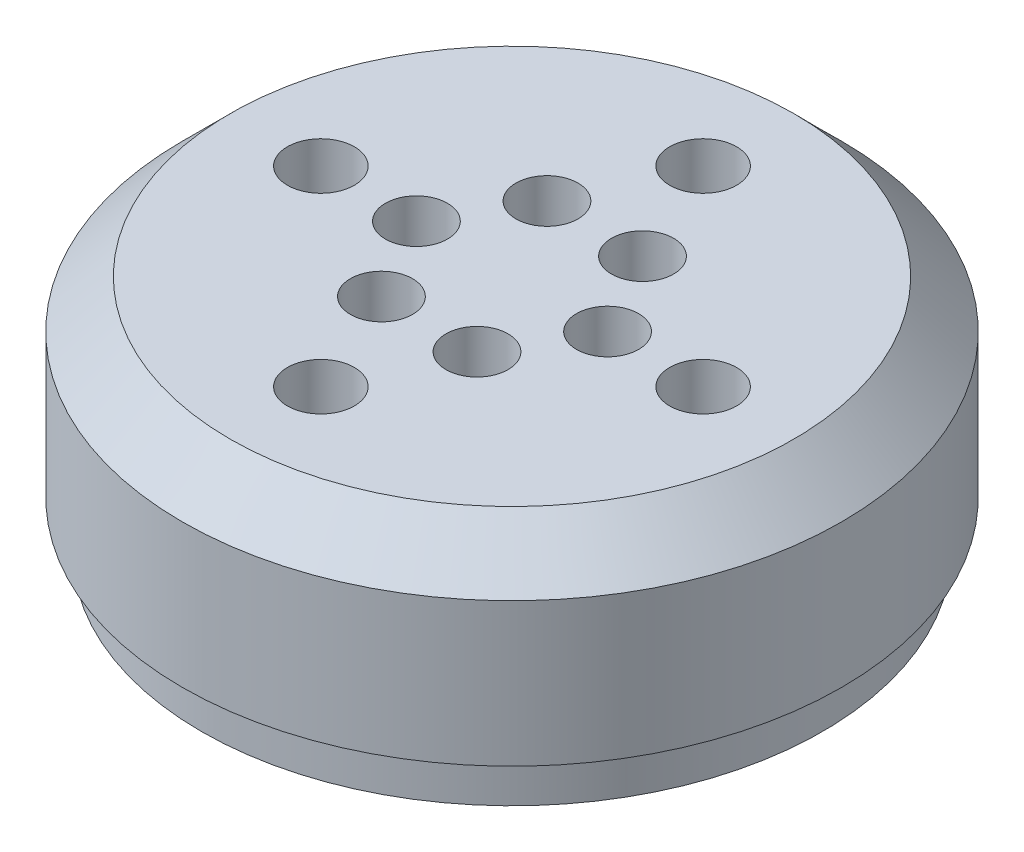
from build123d import *

# Parameters (mm, degrees)
SKETCH1_R           = 32.5
BOSS_EXTRUDE1_DEPTH = 5
SKETCH3_R           = 34.5
BOSS_EXTRUDE3_DEPTH = 20
SKETCH2_R           = 1.25
SKETCH2_R_2         = 4
CUT_EXTRUDE1_DEPTH  = 11.5
SKETCH4_R           = 3.25
CUT_EXTRUDE2_DEPTH  = 21
SKETCH5_R           = 3.5
CUT_EXTRUDE3_DEPTH  = 21.5
CHAMFER1_SIZE       = 5


with BuildPart() as part:
    # Sketch1 → Boss-Extrude1 (new body)
    with BuildSketch(Plane(origin=(0, 0, 0), x_dir=(1, 0, 0), z_dir=(0, 1, 0))):
        with Locations(Location((0, 0, 0), (0, 0, 270))):
            Circle(SKETCH1_R)
    extrude(amount=BOSS_EXTRUDE1_DEPTH)

    # Sketch3 → Boss-Extrude3 (add)
    with BuildSketch(Plane(origin=(0, 5, 0), x_dir=(1, 0, 0), z_dir=(0, 1, 0))):
        with Locations(Location((0, 0, 0), (0, 0, 270))):
            Circle(SKETCH3_R)
    extrude(amount=BOSS_EXTRUDE3_DEPTH)

    # Sketch2 → Cut-Extrude1 (cut)
    with BuildSketch(Plane(origin=(0, 0, 0), x_dir=(1, 0, 0), z_dir=(0, 1, 0))):
        with Locations(Location((-5, 8.660254038, 0), (0, 0, 270))):
            Circle(SKETCH2_R)
        with Locations(Location((5, 8.660254038, 0), (0, 0, 270))):
            Circle(SKETCH2_R)
        with Locations(Location((10, 0, 0), (0, 0, 270))):
            Circle(SKETCH2_R)
        with Locations(Location((5, -8.660254038, 0), (0, 0, 270))):
            Circle(SKETCH2_R)
        with Locations(Location((-5, -8.660254038, 0), (0, 0, 270))):
            Circle(SKETCH2_R)
        with Locations(Location((-10, 0, 0), (0, 0, 270))):
            Circle(SKETCH2_R)
        with Locations(Location((0, 0, 0), (0, 0, 270))):
            Circle(SKETCH2_R_2)
    extrude(amount=CUT_EXTRUDE1_DEPTH, mode=Mode.SUBTRACT)

    # Sketch4 → Cut-Extrude2 (cut)
    with BuildSketch(Plane(origin=(0, 25, 0), x_dir=(1, 0, 0), z_dir=(0, 1, 0))):
        with Locations(Location((10, 0, 0), (0, 0, 270))):
            Circle(SKETCH4_R)
        with Locations(Location((5, 8.660254038, 0), (0, 0, 270))):
            Circle(SKETCH4_R)
        with Locations(Location((5, -8.660254038, 0), (0, 0, 270))):
            Circle(SKETCH4_R)
        with Locations(Location((-5, -8.660254038, 0), (0, 0, 270))):
            Circle(SKETCH4_R)
        with Locations(Location((-10, 0, 0), (0, 0, 270))):
            Circle(SKETCH4_R)
        with Locations(Location((-5, 8.660254038, 0), (0, 0, 270))):
            Circle(SKETCH4_R)
    extrude(amount=-CUT_EXTRUDE2_DEPTH, mode=Mode.SUBTRACT)

    # Sketch5 → Cut-Extrude3 (cut)
    with BuildSketch(Plane(origin=(0, 25, 0), x_dir=(1, 0, 0), z_dir=(0, 1, 0))):
        with Locations(Location((0, 20, 0), (0, 0, 270))):
            Circle(SKETCH5_R)
        with Locations(Location((20, 0, 0), (0, 0, 270))):
            Circle(SKETCH5_R)
        with Locations(Location((0, -20, 0), (0, 0, 270))):
            Circle(SKETCH5_R)
        with Locations(Location((-20, 0, 0), (0, 0, 270))):
            Circle(SKETCH5_R)
    extrude(amount=-CUT_EXTRUDE3_DEPTH, mode=Mode.SUBTRACT)

    # Chamfer1
    chamfer1_edges = [part.edges().sort_by_distance(p)[0] for p in [
        (0, 25, -34.5),
    ]]
    chamfer(chamfer1_edges, length=CHAMFER1_SIZE)


solid = part.part
